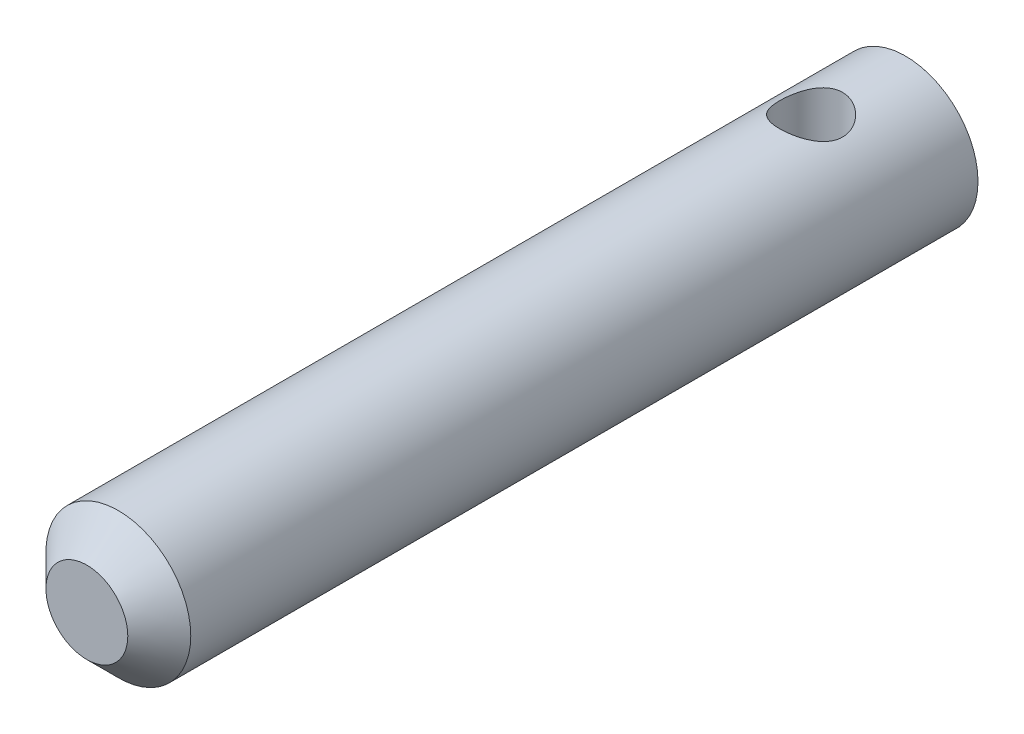
from build123d import *

# Parameters (mm, degrees)
SKETCH1_R               = 11.5
BOSS_EXTRUDE1_DEPTH     = 130
CHAMFER1_SIZE           = 5
CUT_EXTRUDE1_DEPTH      = 132.013358098
CUT_EXTRUDE1_DEPTH_BACK = 132.013358098
SKETCH2_R               = 5


with BuildPart() as part:
    # Sketch1 → Boss-Extrude1 (new body)
    with BuildSketch(Plane.XY):
        Circle(SKETCH1_R)
    extrude(amount=BOSS_EXTRUDE1_DEPTH)

    # Chamfer1
    chamfer1_edges = [part.edges().sort_by_distance(p)[0] for p in [
        (-11.5, 0, 130),
    ]]
    chamfer(chamfer1_edges, length=CHAMFER1_SIZE)

    # Sketch2 → Cut-Extrude1 (cut, two sides: drawn at the far end of the back side and taken through both)
    with BuildSketch(Plane(origin=(0, 0, 0), x_dir=(1, 0, 0), z_dir=(0, 1, 0)).offset(-CUT_EXTRUDE1_DEPTH_BACK)):
        with Locations(Location((0, -15, 0), (0, 0, 270))):
            Circle(SKETCH2_R)
    extrude(amount=CUT_EXTRUDE1_DEPTH + CUT_EXTRUDE1_DEPTH_BACK, mode=Mode.SUBTRACT)


solid = part.part
